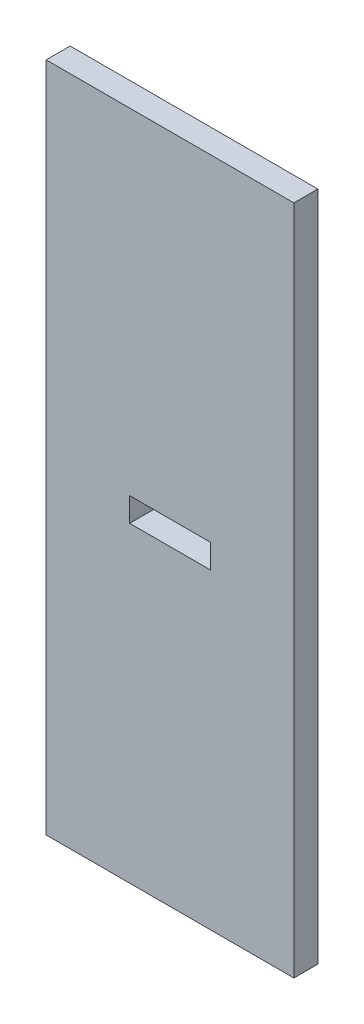
from build123d import *

# Parameters (mm, degrees)
ESQUISSE1_W        = 31
ESQUISSE1_H        = 84
ESQUISSE1_W_2      = 10.1
ESQUISSE1_H_2      = 3
BOSS_EXTRU_1_DEPTH = 3


with BuildPart() as part:
    # Esquisse1 → Boss.-Extru.1 (new body)
    with BuildSketch(Plane.XY):
        with Locations((15.5, 42)):
            Rectangle(ESQUISSE1_W, ESQUISSE1_H)
        with Locations((15.5, 40.5)):
            Rectangle(ESQUISSE1_W_2, ESQUISSE1_H_2, mode=Mode.SUBTRACT)
    extrude(amount=BOSS_EXTRU_1_DEPTH)


solid = part.part
